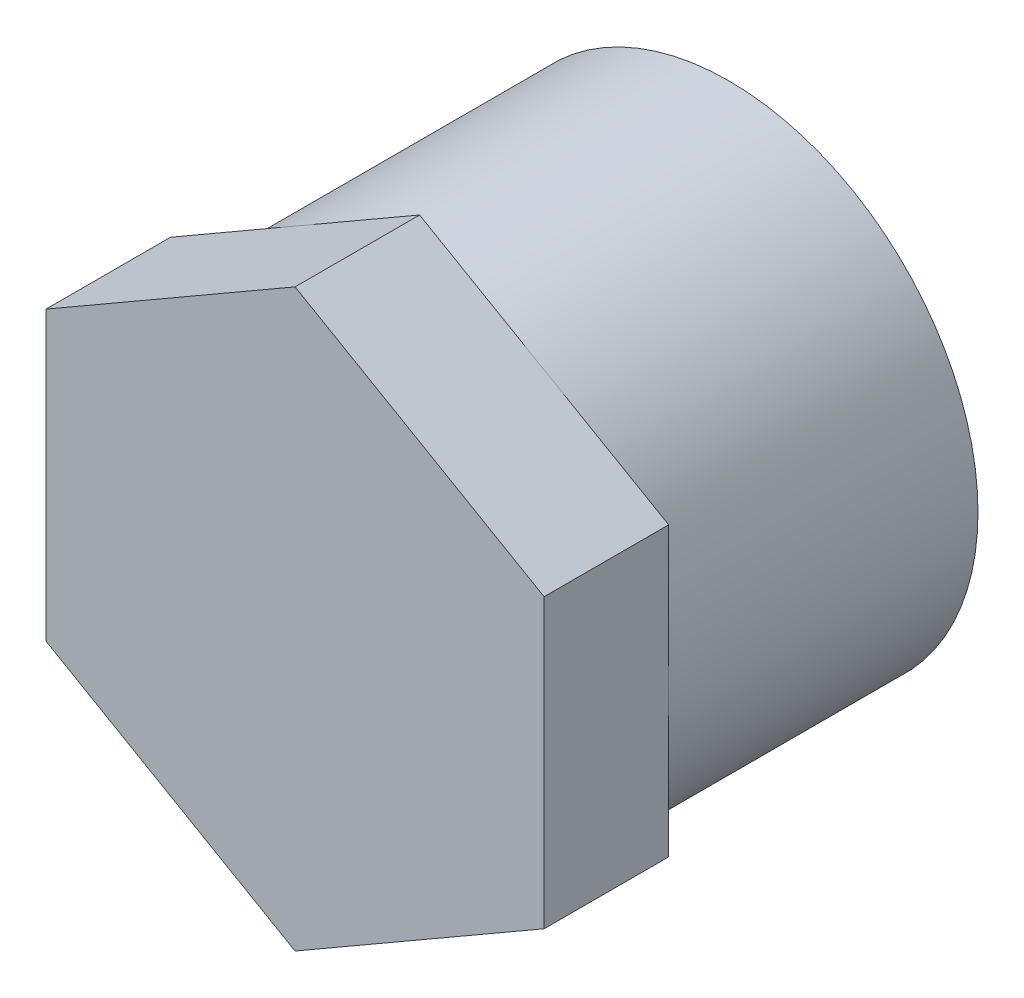
from build123d import *

# Parameters (mm, degrees)
BOSS_EXTRUDE1_DEPTH      = 5
BOSS_EXTRUDE1_DEPTH_BACK = 7.42
SKETCH1_R                = 10
BOSS_EXTRUDE2_DEPTH      = 5


with BuildPart() as part:
    # Sketch1 → Boss-Extrude1 (new, two sides: drawn at the far end of the back side and taken through both)
    with BuildSketch(Plane.XY.offset(-BOSS_EXTRUDE1_DEPTH_BACK)):
        Circle(SKETCH1_R)
    extrude(amount=BOSS_EXTRUDE1_DEPTH + BOSS_EXTRUDE1_DEPTH_BACK)

    # Sketch2 → Boss-Extrude2 (add)
    with BuildSketch(Plane.XY.offset(5)):
        Polygon((0, 11.547005384), (-10, 5.773502692), (-10, -5.773502692), (0, -11.547005384), (10, -5.773502692), (10, 5.773502692), align=None)
    extrude(amount=BOSS_EXTRUDE2_DEPTH)


solid = part.part
